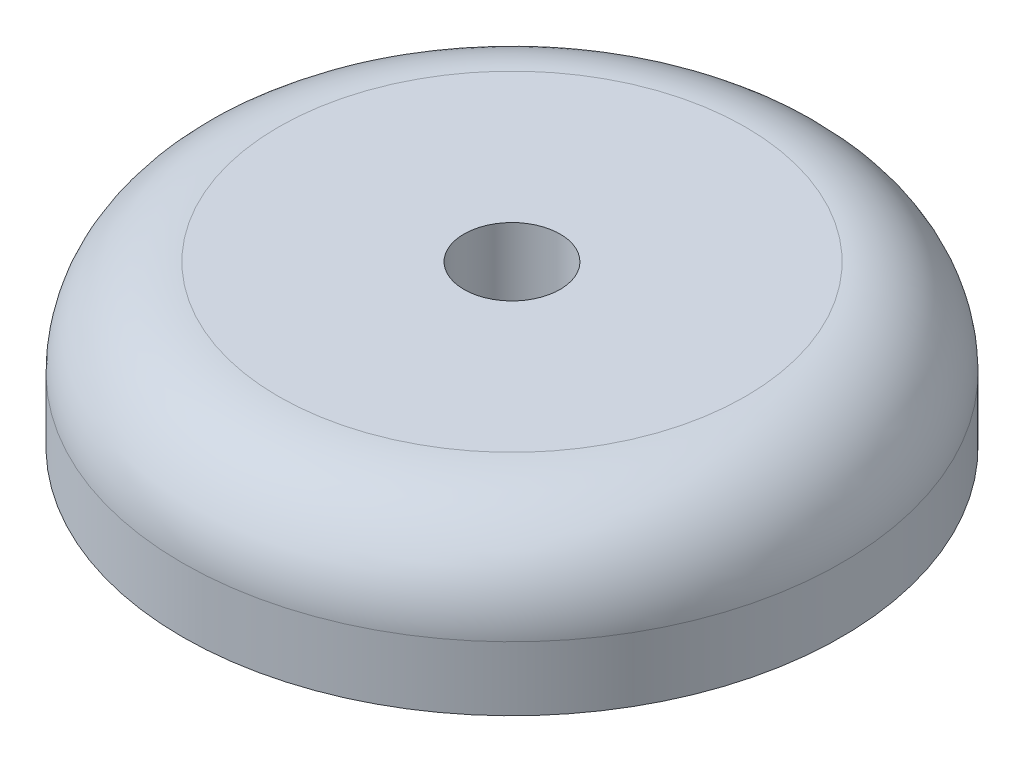
from build123d import *

# Parameters (mm, degrees)
SKETCH1_R           = 10.287
SKETCH1_R_2         = 1.5
BOSS_EXTRUDE1_DEPTH = 5
FILLET1_R           = 3


with BuildPart() as part:
    # Sketch1 → Boss-Extrude1 (new body)
    with BuildSketch(Plane(origin=(0, 0, 0), x_dir=(1, 0, 0), z_dir=(0, 1, 0))):
        with Locations(Location((0, 0, 0), (0, 0, 270))):
            Circle(SKETCH1_R)
        with Locations(Location((0, 0, 0), (0, 0, 270))):
            Circle(SKETCH1_R_2, mode=Mode.SUBTRACT)
    extrude(amount=BOSS_EXTRUDE1_DEPTH)

    # Fillet1
    fillet1_edges = [part.edges().sort_by_distance(p)[0] for p in [
        (0, 5, -10.287),
    ]]
    fillet(fillet1_edges, radius=FILLET1_R)


solid = part.part
